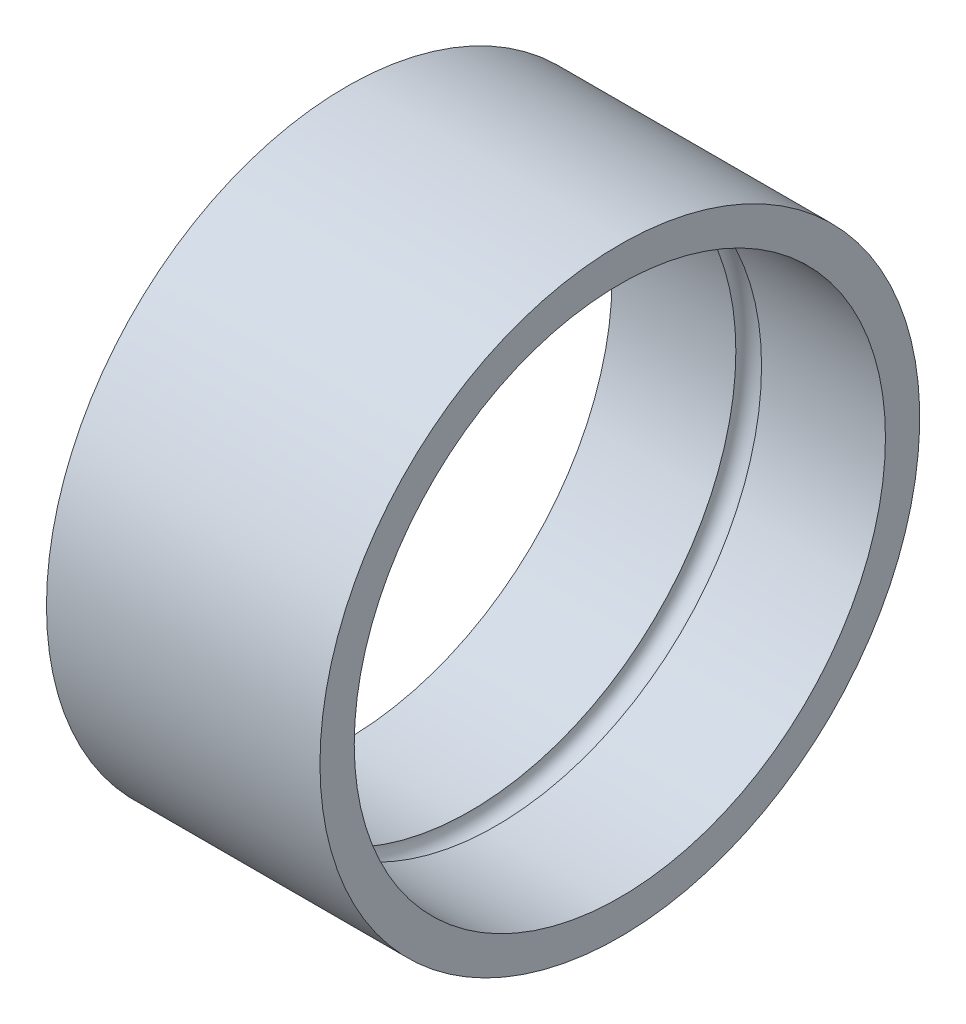
from build123d import *


with BuildPart() as part:
    # Esboço1 → Revolução1 (revolve)
    with BuildSketch(Plane.XY, mode=Mode.PRIVATE) as revolu_o1_sk:
        with BuildLine():
            Line((0.75, 15.5), (7.98, 15.5))
            Line((7.98, 15.5), (7.98, 17.5))
            Line((7.98, 17.5), (-7.98, 17.5))
            Line((-7.98, 17.5), (-7.98, 15.5))
            Line((-7.98, 15.5), (-0.75, 15.5))
            ThreePointArc((-0.75, 15.5), (0, 16.25), (0.75, 15.5))
        make_face()
    revolve(revolu_o1_sk.sketch.rotate(Axis((-7.98, 0, 0), (1, 0, 0)), 90), axis=Axis((-7.98, 0, 0), (1, 0, 0)))


solid = part.part
